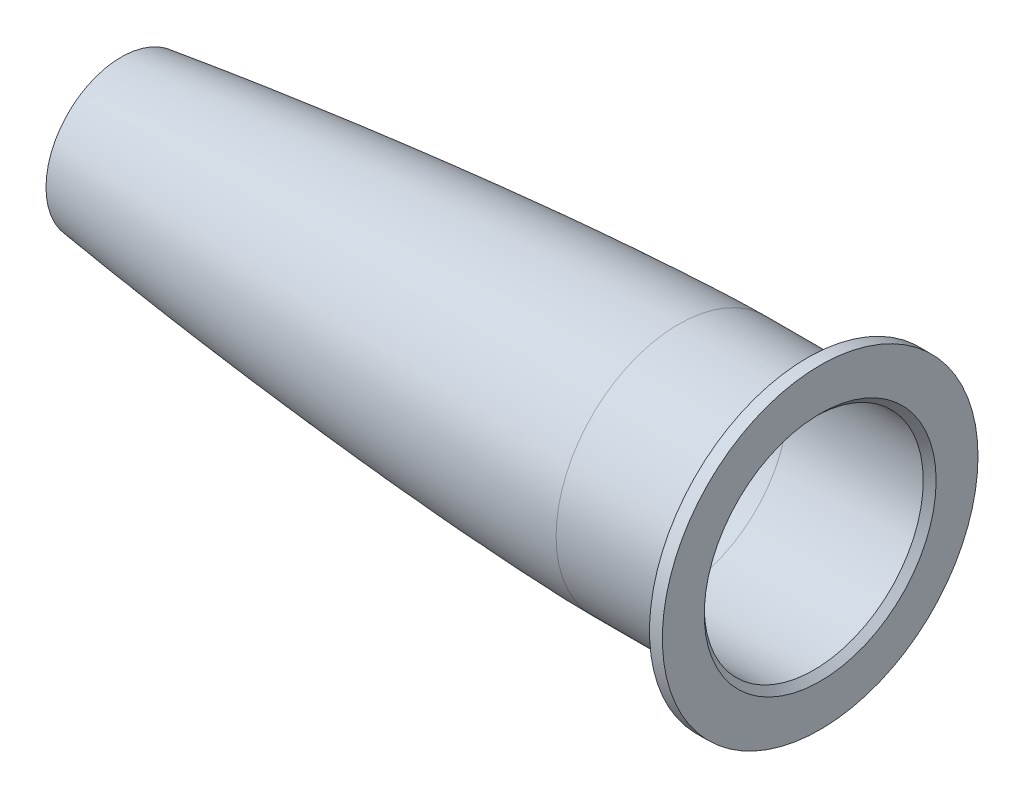
from build123d import *

# Parameters (mm, degrees)
SKETCH3_R           = 3.1
CUT_EXTRUDE1_DEPTH  = 222.614539842
BOSS_EXTRUDE1_START = 4
SKETCH4_R           = 49.000027987
SKETCH4_R_2         = 34.000027987
BOSS_EXTRUDE1_DEPTH = 4
CHAMFER1_SIZE       = 2
SKETCH5_R           = 1.5
BOSS_EXTRUDE2_DEPTH = 2


with BuildPart() as part:
    # Sketch2 → Revolve1 (revolve)
    with BuildSketch(Plane.XY, mode=Mode.PRIVATE) as revolve1_sk:
        with BuildLine():
            Line((340, 38.000027987), (300.010580524, 38.000027987))
            add(Edge.make_bspline(
                [(127, 23.368217816), (127.144658905, 23.387357923), (141.067067172, 25.227802685), (169.534203287, 28.668411554), (205.200950651, 32.237503735), (234.354838071, 34.660219308), (256.239727532, 36.200460456), (274.483617298, 37.216214614), (289.091810146, 37.788845449), (296.367863688, 37.980756791), (300.010580524, 38.000027987)],
                knots=[0.426924824, 0.426924824, 0.426924824, 0.426924824, 0.428368468, 0.565862687, 0.710575124, 0.782931343, 0.855287562, 0.927643781, 0.963821891, 1, 1, 1, 1], degree=3))
            Line((127, 23.368217816), (127, 0))
            Line((127, 0), (131, 0))
            Line((131, 0), (131, 20))
            ThreePointArc((131, 20), (215.320786735, 29.227370129), (300.010580524, 34.000027987))
            Line((300.010580524, 34.000027987), (340, 34.000027987))
            Line((340, 34.000027987), (340, 38.000027987))
        make_face()
    revolve(revolve1_sk.sketch.rotate(Axis((0, 0, 0), (1, 0, 0)), 90), axis=Axis((0, 0, 0), (1, 0, 0)))

    # Sketch3 → Cut-Extrude1 (cut, through all)
    with BuildSketch(Plane.ZY.offset(-125)):
        Circle(SKETCH3_R)
    extrude(amount=-CUT_EXTRUDE1_DEPTH, mode=Mode.SUBTRACT)

    # Sketch4 → Boss-Extrude1 (add)
    with BuildSketch(Plane(origin=(340, 0, 0), x_dir=(0, 0, -1), z_dir=(1, 0, 0)).offset(BOSS_EXTRUDE1_START)):
        Circle(SKETCH4_R)
        with Locations(Location((0, 0, 0), (0, 0, 180))):
            Circle(SKETCH4_R_2, mode=Mode.SUBTRACT)
    extrude(amount=-BOSS_EXTRUDE1_DEPTH)

    # Chamfer1
    chamfer1_edges = [part.edges().sort_by_distance(p)[0] for p in [
        (344, 0, -34.000027987),
    ]]
    chamfer(chamfer1_edges, length=CHAMFER1_SIZE)

    # Sketch5 → Boss-Extrude2 (add)
    with BuildSketch(Plane.ZY.offset(-127)):
        with Locations((0, 15)):
            Circle(SKETCH5_R)
        with Locations((15, 0)):
            Circle(SKETCH5_R)
        with Locations((-15, 0)):
            Circle(SKETCH5_R)
        with Locations((0, -15)):
            Circle(SKETCH5_R)
    extrude(amount=BOSS_EXTRUDE2_DEPTH)


solid = part.part
